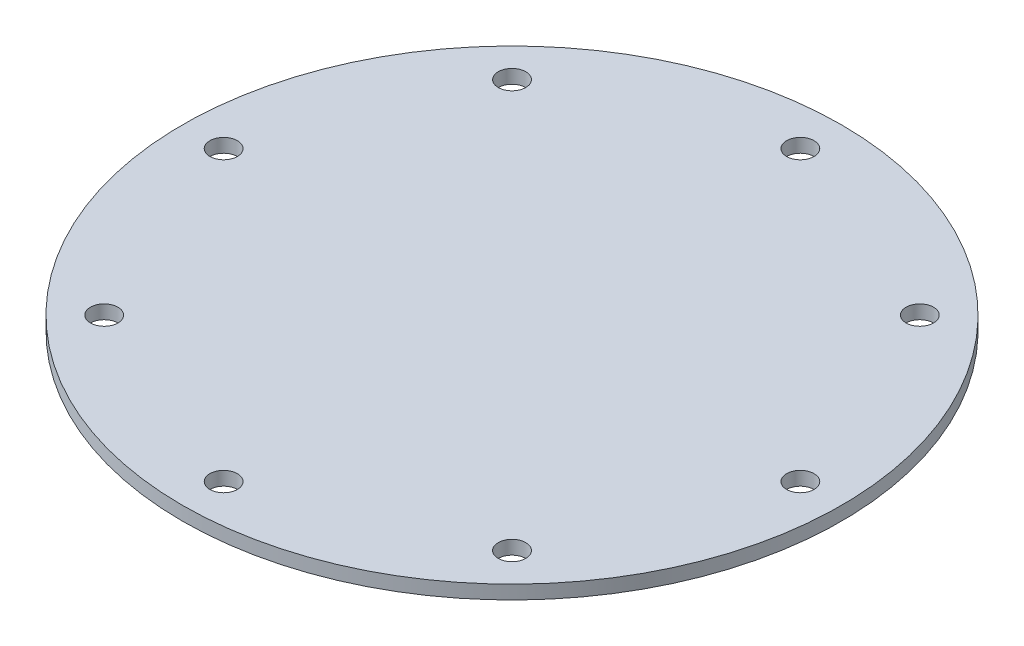
from build123d import *

# Parameters (mm, degrees)
SKETCH_9_R               = 120
EXTRUDE_1_DEPTH          = 5
PATTERN_CIRCULAR_1_COUNT = 8


with BuildPart() as part:
    # Эскиз9 → Бобышка-Вытянуть1 (new body)
    with BuildSketch(Plane(origin=(0, 0, 0), x_dir=(1, 0, 0), z_dir=(0, 1, 0))):
        Circle(SKETCH_9_R)
    extrude(amount=EXTRUDE_1_DEPTH)

    # Эскиз13 → Диаметр отверстия Ø10.0 (10)1 (revolve, cut)
    with BuildSketch(Plane(origin=(105, 5, 0), x_dir=(0, 0, 1), z_dir=(1, 0, 0))):
        Polygon((0, 0), (0, 18.004303095), (5, 15), (5, 0), align=None)
    hole_wizard_10_0_10_1 = revolve(axis=Axis((105, 11.35, 0), (0, -1, 0)), mode=Mode.SUBTRACT)

    # Круговой массив1: Диаметр отверстия Ø10.0 (10)1 ×8 about axis
    pattern_circular_1_axis = Axis((0, 50, 0), (0, -1, 0))
    for i in range(1, PATTERN_CIRCULAR_1_COUNT):
        add(hole_wizard_10_0_10_1.rotate(pattern_circular_1_axis, i * 360 / PATTERN_CIRCULAR_1_COUNT), mode=Mode.SUBTRACT)


solid = part.part
